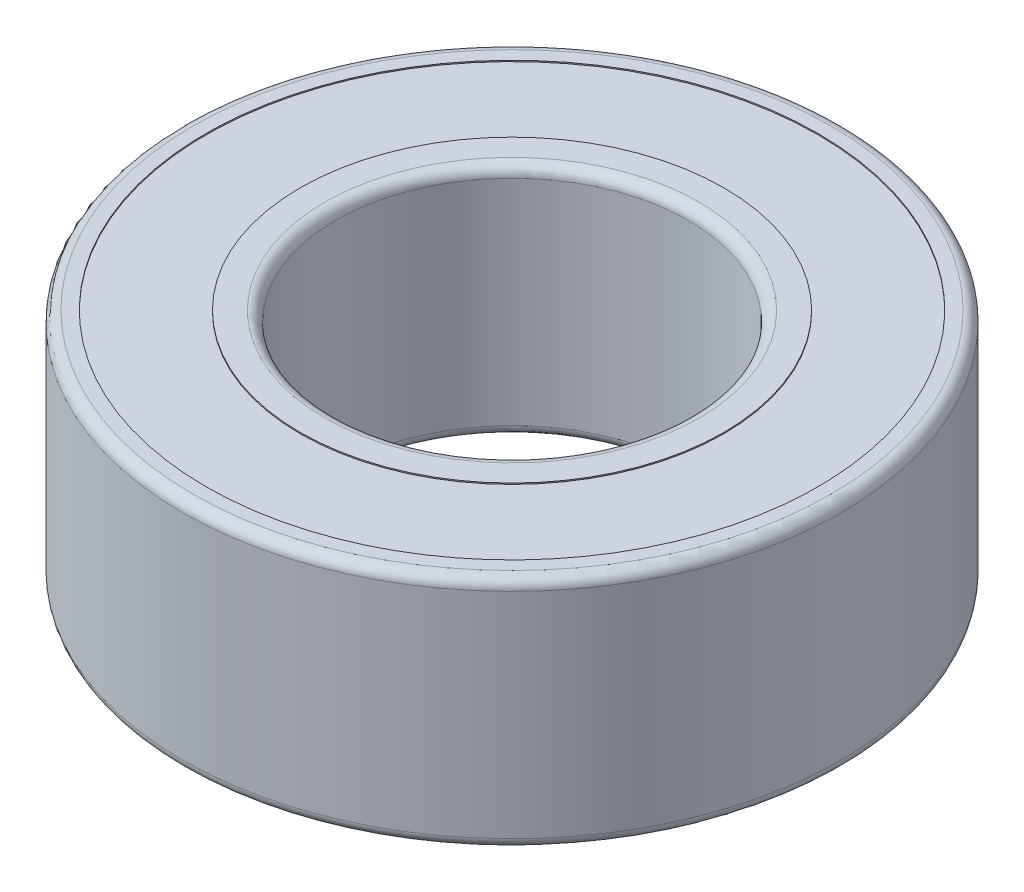
from build123d import *

# Parameters (mm, degrees)
SKETCH1_R           = 14
SKETCH1_R_2         = 7.5
BOSS_EXTRUDE1_DEPTH = 5
SKETCH2_R           = 13
SKETCH2_R_2         = 9
CUT_EXTRUDE1_DEPTH  = 0.05
FILLET1_R           = 0.45


with BuildPart() as part:
    # Sketch1 → Boss-Extrude1 (new, symmetric)
    with BuildSketch(Plane(origin=(0, 0, 0), x_dir=(1, 0, 0), z_dir=(0, 1, 0))):
        Circle(SKETCH1_R)
        Circle(SKETCH1_R_2, mode=Mode.SUBTRACT)
    extrude(amount=BOSS_EXTRUDE1_DEPTH, both=True)

    # Sketch2 → Cut-Extrude1 (cut)
    with BuildSketch(Plane(origin=(0, 5, 0), x_dir=(1, 0, 0), z_dir=(0, 1, 0))):
        Circle(SKETCH2_R)
        Circle(SKETCH2_R_2, mode=Mode.SUBTRACT)
    cut_extrude1 = extrude(amount=-CUT_EXTRUDE1_DEPTH, mode=Mode.SUBTRACT)

    # Mirror1: Cut-Extrude1 across plane
    add(cut_extrude1.mirror(Plane.ZX), mode=Mode.SUBTRACT)

    # Fillet1
    fillet1_edges = [part.edges().sort_by_distance(p)[0] for p in [
        (-7.5, -5, 0),
        (-7.5, 5, 0),
        (-14, -5, 0),
        (-14, 5, 0),
    ]]
    fillet(fillet1_edges, radius=FILLET1_R)


solid = part.part
